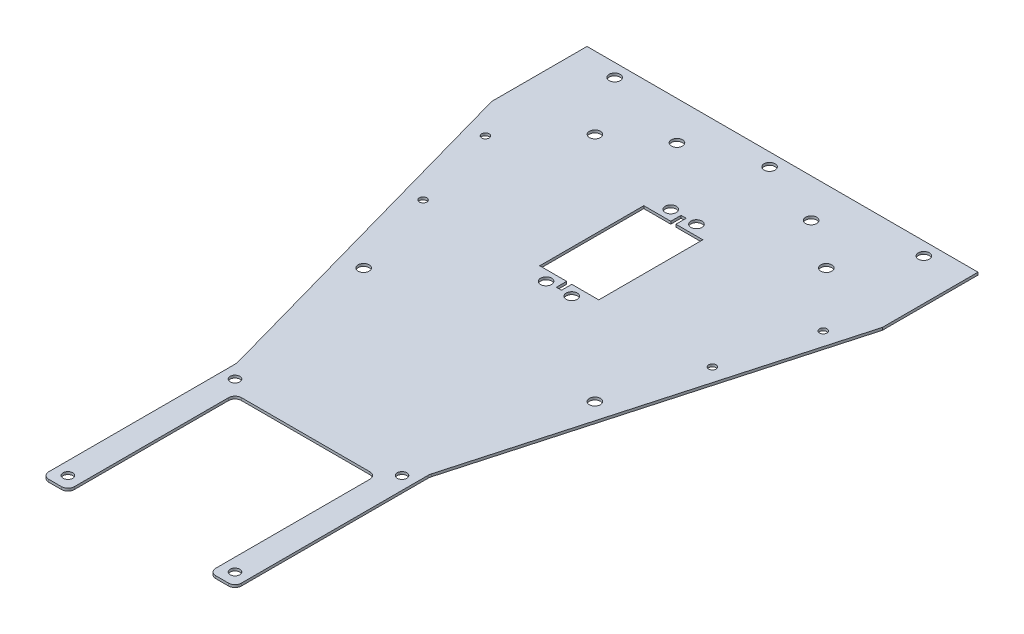
from build123d import *

# Parameters (mm, degrees)
SKETCH26_R          = 1.875
SKETCH26_R_2        = 2.15
SKETCH26_R_3        = 1.45
BOSS_EXTRUDE6_DEPTH = 1


with BuildPart() as part:
    # Sketch26 → Boss-Extrude6 (new body)
    with BuildSketch(Plane(origin=(0, 0, 0), x_dir=(1, 0, 0), z_dir=(0, 1, 0))):
        with BuildLine():
            Line((76.013272408, 51.623832483), (76.013272408, 88.823544949))
            Line((76.013272408, 88.823544949), (-76.102081629, 88.823544949))
            Line((-76.102081629, 88.823544949), (-76.102081629, 51.776273242))
            Line((-76.102081629, 51.776273242), (-37.685470178, -85.312264175))
            ThreePointArc((-37.685470178, -85.312264175), (-37.546584556, -85.980512893), (-37.5, -86.661450073))
            Line((-37.5, -86.661450073), (-37.5, -159.216442532))
            ThreePointArc((-37.5, -159.216442532), (-36.767766953, -160.984209485), (-35, -161.716442532))
            Line((-35, -161.716442532), (-30, -161.716442532))
            ThreePointArc((-30, -161.716442532), (-28.232405329, -160.98438175), (-27.500000047, -159.216929795))
            Line((-27.500000047, -159.216929795), (-27.488305541, -99.215955269))
            ThreePointArc((-27.488305541, -99.215955269), (-26.755900259, -97.448503314), (-24.988305588, -96.716442532))
            Line((-24.988305588, -96.716442532), (24.988305588, -96.716442532))
            ThreePointArc((24.988305588, -96.716442532), (26.756072541, -97.448675579), (27.488305588, -99.216442532))
            Line((27.488305588, -99.216442532), (27.488305588, -159.216442532))
            ThreePointArc((27.488305588, -159.216442532), (28.220538635, -160.984209485), (29.988305588, -161.716442532))
            Line((29.988305588, -161.716442532), (34.988305588, -161.716442532))
            ThreePointArc((34.988305588, -161.716442532), (36.756072541, -160.984209485), (37.488305588, -159.216442532))
            Line((37.488305588, -159.216442532), (37.488305588, -86.69785128))
            ThreePointArc((37.488305588, -86.69785128), (37.534787412, -86.017661841), (37.673368657, -85.350118981))
            Line((37.673368657, -85.350118981), (75.502125614, 49.797698633))
            Line((75.502125614, 49.797698633), (76.013272408, 51.623832483))
        make_face()
        with Locations(Location((-32.5, -156.716442532, 0), (0, 0, 270))):
            Circle(SKETCH26_R, mode=Mode.SUBTRACT)
        with Locations(Location((-32.5, -91.716442532, 0), (0, 0, 270))):
            Circle(SKETCH26_R, mode=Mode.SUBTRACT)
        with Locations(Location((32.488305588, -156.716442532, 0), (0, 0, 270))):
            Circle(SKETCH26_R, mode=Mode.SUBTRACT)
        with Locations(Location((32.488305588, -91.716442532, 0), (0, 0, 270))):
            Circle(SKETCH26_R, mode=Mode.SUBTRACT)
        with Locations(Location((-44.91002895, -29.282587791, 0), (0, 0, 270))):
            Circle(SKETCH26_R_2, mode=Mode.SUBTRACT)
        with Locations(Location((-56.275133419, 5.22710987, 0), (0, 0, 270))):
            Circle(SKETCH26_R_3, mode=Mode.SUBTRACT)
        with Locations(Location((-4.91002895, 1.717412209, 0), (0, 0, 270))):
            Circle(SKETCH26_R_2, mode=Mode.SUBTRACT)
        with Locations(Location((-65.710275059, 38.931384113, 0), (0, 0, 270))):
            Circle(SKETCH26_R_3, mode=Mode.SUBTRACT)
        with Locations(Location((-60.263272408, 83.747616616, 0), (0, 0, 270))):
            Circle(SKETCH26_R_2, mode=Mode.SUBTRACT)
        with Locations(Location((-44.91002895, 60.717412209, 0), (0, 0, 270))):
            Circle(SKETCH26_R_2, mode=Mode.SUBTRACT)
        with Locations(Location((-4.91002895, 50.217412209, 0), (0, 0, 270))):
            Circle(SKETCH26_R_2, mode=Mode.SUBTRACT)
        with Locations(Location((-26.102081629, 73.823544949, 0), (0, 0, 270))):
            Circle(SKETCH26_R_2, mode=Mode.SUBTRACT)
        with Locations(Location((5.08997105, 1.717412209, 0), (0, 0, 270))):
            Circle(SKETCH26_R_2, mode=Mode.SUBTRACT)
        Polygon((11.577692982, 46.217412209), (11.577692982, 5.717412209), (1.08997105, 5.717412209), (1.08997105, 1.717412209), (-0.91002895, 1.717412209), (-0.91002895, 5.717412209), (-11.397750883, 5.717412209), (-11.397750883, 46.217412209), (-0.91002895, 46.217412209), (-0.91002895, 50.217412209), (1.08997105, 50.217412209), (1.08997105, 46.217412209), align=None, mode=Mode.SUBTRACT)
        with Locations(Location((45.08997105, -29.282587791, 0), (0, 0, 270))):
            Circle(SKETCH26_R_2, mode=Mode.SUBTRACT)
        with Locations(Location((56.276531408, 5.226515161, 0), (0, 0, 270))):
            Circle(SKETCH26_R_3, mode=Mode.SUBTRACT)
        with Locations(Location((5.08997105, 50.217412209, 0), (0, 0, 270))):
            Circle(SKETCH26_R_2, mode=Mode.SUBTRACT)
        with Locations(Location((0, 83.74802142, 0), (0, 0, 270))):
            Circle(SKETCH26_R_2, mode=Mode.SUBTRACT)
        with Locations(Location((26.102081629, 73.823544949, 0), (0, 0, 270))):
            Circle(SKETCH26_R_2, mode=Mode.SUBTRACT)
        with Locations(Location((65.7106575, 38.931073679, 0), (0, 0, 270))):
            Circle(SKETCH26_R_3, mode=Mode.SUBTRACT)
        with Locations(Location((45.08997105, 60.717412209, 0), (0, 0, 270))):
            Circle(SKETCH26_R_2, mode=Mode.SUBTRACT)
        with Locations(Location((59.999999999, 83.747618385, 0), (0, 0, 270))):
            Circle(SKETCH26_R_2, mode=Mode.SUBTRACT)
    extrude(amount=BOSS_EXTRUDE6_DEPTH)


solid = part.part
